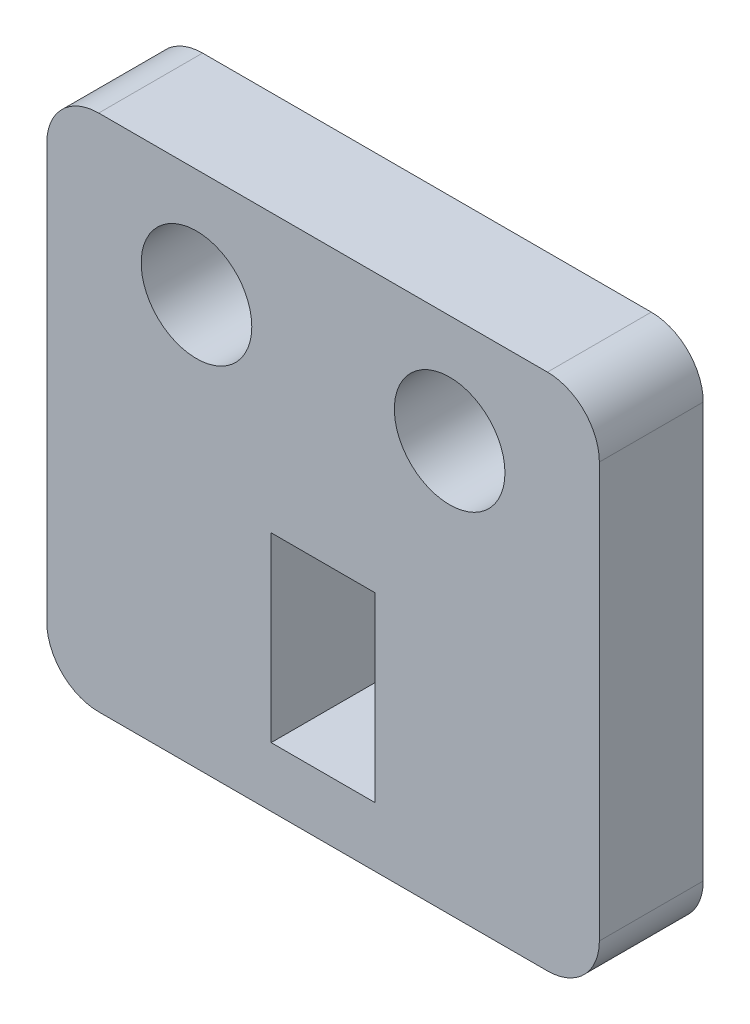
from build123d import *

# Parameters (mm, degrees)
ESQUISSE1_W        = 21.281999849
ESQUISSE1_H        = 19.97412287
ESQUISSE1_R        = 2.13
ESQUISSE1_W_2      = 4
ESQUISSE1_H_2      = 7
BOSS_EXTRU_1_DEPTH = 4
CONG_1_R           = 2


with BuildPart() as part:
    # Esquisse1 → Boss.-Extru.1 (new body)
    with BuildSketch(Plane.XY):
        with Locations((10.640999925, 9.987061435)):
            Rectangle(ESQUISSE1_W, ESQUISSE1_H)
        with Locations((5.765999924, 15.79412287)):
            Circle(ESQUISSE1_R, mode=Mode.SUBTRACT)
        with Locations((15.515999924, 15.79412287)):
            Circle(ESQUISSE1_R, mode=Mode.SUBTRACT)
        with Locations((10.640999924, 5.79412287)):
            Rectangle(ESQUISSE1_W_2, ESQUISSE1_H_2, mode=Mode.SUBTRACT)
    extrude(amount=BOSS_EXTRU_1_DEPTH)

    # Congé1
    cong_1_edges = [part.edges().sort_by_distance(p)[0] for p in [
        (0, 19.97412287, 2),
        (21.281999849, 19.97412287, 2),
        (21.281999849, 0, 2),
        (0, 0, 2),
    ]]
    fillet(cong_1_edges, radius=CONG_1_R)


solid = part.part
